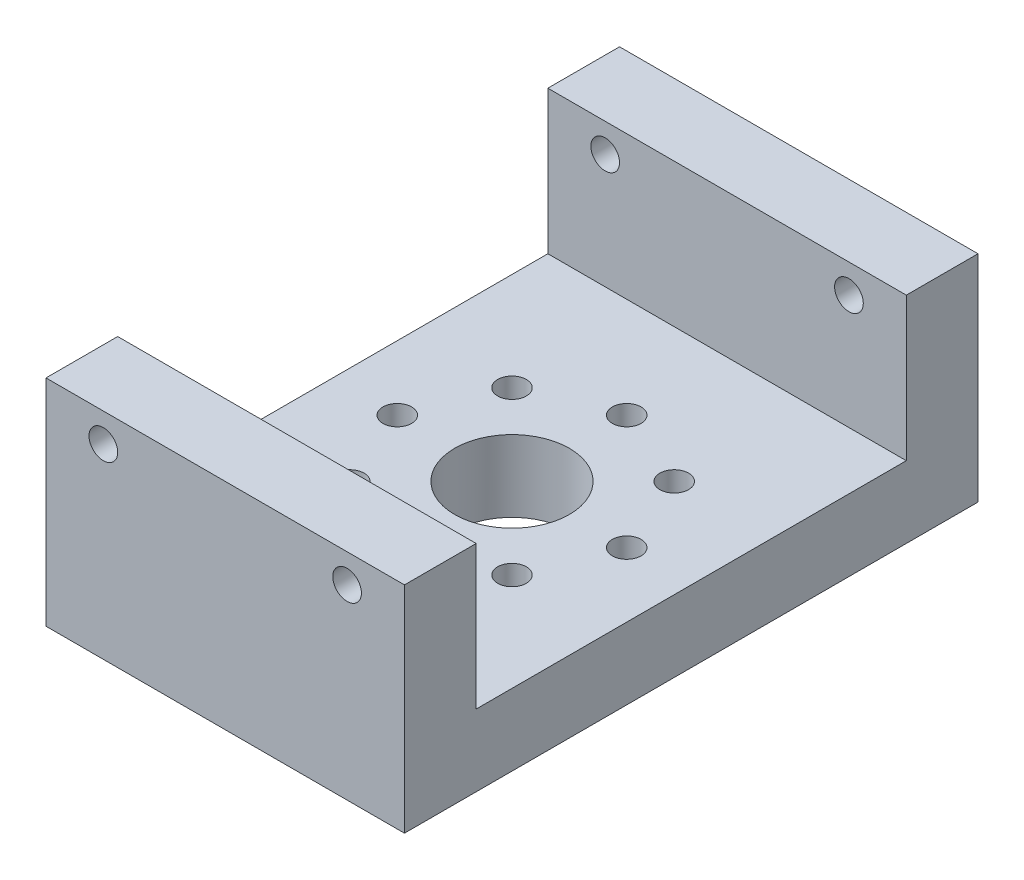
from build123d import *

# Parameters (mm, degrees)
SKETCH1_W           = 25
SKETCH1_H           = 40
BOSS_EXTRUDE1_DEPTH = 5
SKETCH5_W           = 25
SKETCH5_H           = 5
BOSS_EXTRUDE2_DEPTH = 10
SKETCH6_R           = 1
CUT_EXTRUDE3_DEPTH  = 45.511234537
SKETCH7_R           = 4
SKETCH7_R_2         = 1
CUT_EXTRUDE4_DEPTH  = 10


with BuildPart() as part:
    # Sketch1 → Boss-Extrude1 (new body)
    with BuildSketch(Plane(origin=(0, 0, 0), x_dir=(1, 0, 0), z_dir=(0, 1, 0))):
        Rectangle(SKETCH1_W, SKETCH1_H)
    extrude(amount=BOSS_EXTRUDE1_DEPTH)

    # Sketch5 → Boss-Extrude2 (add)
    with BuildSketch(Plane(origin=(0, 5, 0), x_dir=(1, 0, 0), z_dir=(0, 1, 0))):
        with Locations((0, 17.5)):
            Rectangle(SKETCH5_W, SKETCH5_H)
        with Locations((0, -17.5)):
            Rectangle(SKETCH5_W, SKETCH5_H)
    extrude(amount=BOSS_EXTRUDE2_DEPTH)

    # Sketch6 → Cut-Extrude3 (cut, through all)
    with BuildSketch(Plane.XY.offset(20)):
        with Locations((-8.5, 13)):
            Circle(SKETCH6_R)
        with Locations((8.5, 13)):
            Circle(SKETCH6_R)
    extrude(amount=-CUT_EXTRUDE3_DEPTH, mode=Mode.SUBTRACT)

    # Sketch7 → Cut-Extrude4 (cut)
    with BuildSketch(Plane.XZ):
        with Locations(Location((0, 0, 0), (0, 0, 270))):
            Circle(SKETCH7_R)
        with Locations(Location((0, 8, 0), (0, 0, 270))):
            Circle(SKETCH7_R_2)
        with Locations(Location((5.656854249, 5.656854249, 0), (0, 0, 270))):
            Circle(SKETCH7_R_2)
        with Locations(Location((8, 0, 0), (0, 0, 270))):
            Circle(SKETCH7_R_2)
        with Locations(Location((5.656854249, -5.656854249, 0), (0, 0, 270))):
            Circle(SKETCH7_R_2)
        with Locations(Location((0, -8, 0), (0, 0, 270))):
            Circle(SKETCH7_R_2)
        with Locations(Location((-5.656854249, -5.656854249, 0), (0, 0, 270))):
            Circle(SKETCH7_R_2)
        with Locations(Location((-8, 0, 0), (0, 0, 270))):
            Circle(SKETCH7_R_2)
        with Locations(Location((-5.656854249, 5.656854249, 0), (0, 0, 270))):
            Circle(SKETCH7_R_2)
    extrude(amount=-CUT_EXTRUDE4_DEPTH, mode=Mode.SUBTRACT)


solid = part.part
